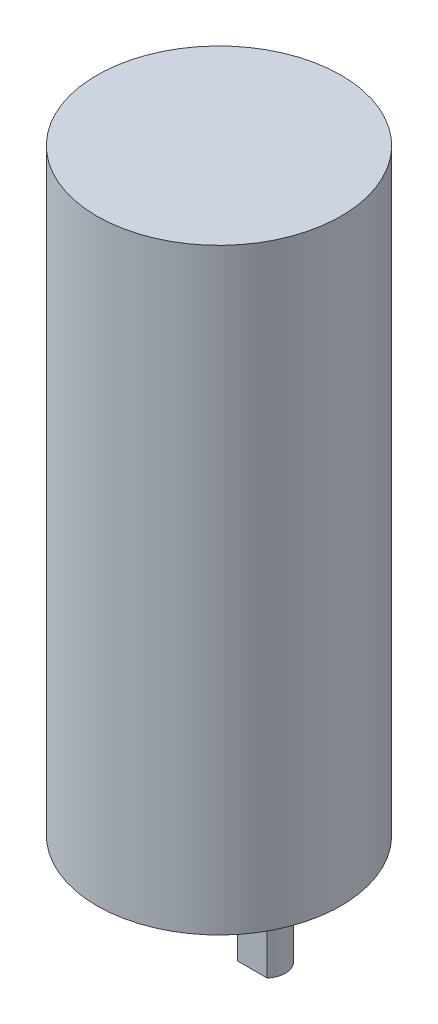
from build123d import *

# Parameters (mm, degrees)
CROQUIS1_R                          = 18.4
SALIENTE_EXTRUIR1_DEPTH             = 90
CROQUIS2_R                          = 3
SALIENTE_EXTRUIR2_DEPTH             = 20
TALADRO_ROSCADO_M3X0_51_D           = 2.5
TALADRO_ROSCADO_M3X0_51_DEPTH       = 8.5
TALADRO_ROSCADO_M3X0_51_CBORE_D     = 3
TALADRO_ROSCADO_M3X0_51_CBORE_DEPTH = 6
TALADRO_ROSCADO_M3X0_51_TIP         = 0.751075774
CROQUIS7_R                          = 6
SALIENTE_EXTRUIR3_DEPTH             = 6.5
CORTAR_EXTRUIR1_DEPTH               = 2
CROQUIS9_W                          = 4.472135954
CROQUIS9_H                          = 10.231682496
CORTAR_EXTRUIR2_DEPTH               = 10


with BuildPart() as part:
    # Croquis1 → Saliente-Extruir1 (new body)
    with BuildSketch(Plane(origin=(0, 0, 0), x_dir=(1, 0, 0), z_dir=(0, 1, 0))):
        with Locations(Location((0, 0, 0), (0, 0, 90))):
            Circle(CROQUIS1_R)
    extrude(amount=SALIENTE_EXTRUIR1_DEPTH)

    # Croquis2 → Saliente-Extruir2 (add)
    with BuildSketch(Plane(origin=(0, 0, 0), x_dir=(-1, 0, 0), z_dir=(0, -1, 0))):
        with Locations(Location((0, 7, 0), (0, 0, 270))):
            Circle(CROQUIS2_R)
    extrude(amount=SALIENTE_EXTRUIR2_DEPTH)

    # Taladro roscado M3x0.51
    with Locations(Plane(origin=(0, 0, 0), x_dir=(-1, 0, 0), z_dir=(0, -1, 0))):
        with Locations((-7.75, -13.423393759), (-15.5, 0), (-7.75, 13.423393759), (7.75, 13.423393759), (15.5, 0), (7.75, -13.423393759)):
            CounterBoreHole(TALADRO_ROSCADO_M3X0_51_D / 2, TALADRO_ROSCADO_M3X0_51_CBORE_D / 2, TALADRO_ROSCADO_M3X0_51_CBORE_DEPTH, depth=TALADRO_ROSCADO_M3X0_51_DEPTH)
            with Locations((0, 0, -(TALADRO_ROSCADO_M3X0_51_DEPTH + TALADRO_ROSCADO_M3X0_51_TIP / 2))):  # 118° drill point
                Cone(0, TALADRO_ROSCADO_M3X0_51_D / 2, TALADRO_ROSCADO_M3X0_51_TIP, mode=Mode.SUBTRACT)

    # Croquis7 → Saliente-Extruir3 (add)
    with BuildSketch(Plane(origin=(0, 0, 0), x_dir=(-1, 0, 0), z_dir=(0, -1, 0))):
        with Locations(Location((0, 7, 0), (0, 0, 270))):
            Circle(CROQUIS7_R)
    extrude(amount=SALIENTE_EXTRUIR3_DEPTH)

    # Croquis8 → Cortar-Extruir1 (cut)
    with BuildSketch(Plane(origin=(0, 0, 0), x_dir=(-1, 0, 0), z_dir=(0, -1, 0))):
        with BuildLine():
            ThreePointArc((-8.481146613, 9.852418593), (0, -13), (8.481146613, 9.852418593))
            ThreePointArc((8.481146613, 9.852418593), (0, -1.947968468), (-8.481146613, 9.852418593))
        make_face()
    extrude(amount=-CORTAR_EXTRUIR1_DEPTH, mode=Mode.SUBTRACT)

    # Croquis9 → Cortar-Extruir2 (cut)
    with BuildSketch(Plane.XZ.offset(20)):
        with Locations((0, 0.115841248)):
            Rectangle(CROQUIS9_W, CROQUIS9_H)
    extrude(amount=-CORTAR_EXTRUIR2_DEPTH, mode=Mode.SUBTRACT)


solid = part.part
